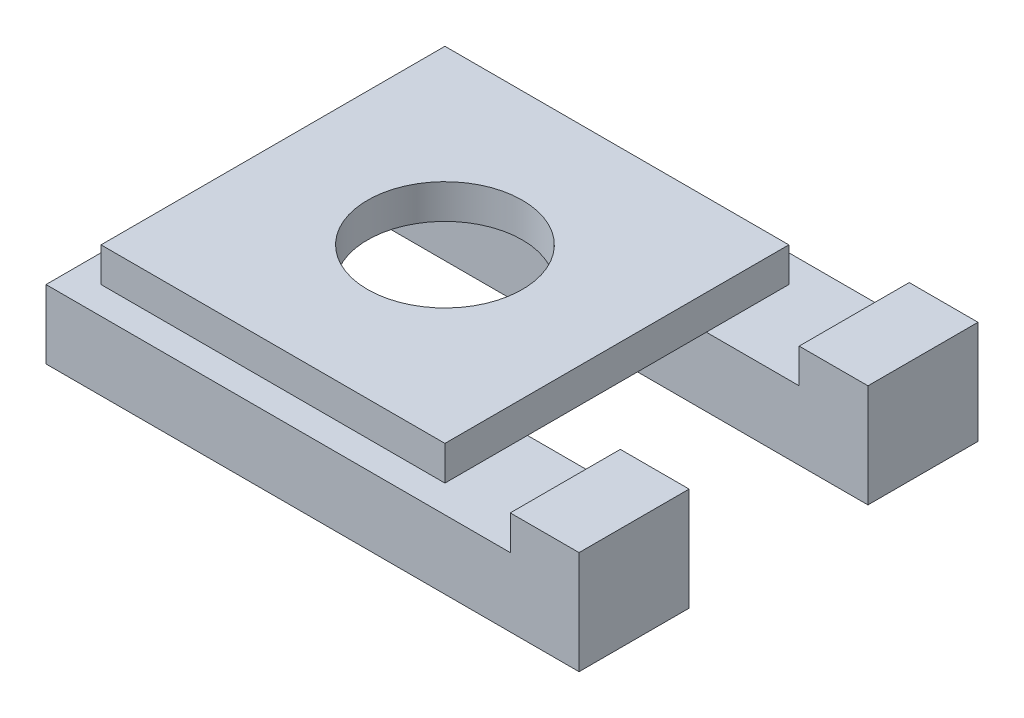
from build123d import *

# Parameters (mm, degrees)
SKETCH1_W           = 100
SKETCH1_H           = 100
SKETCH1_R           = 22.5
BOSS_EXTRUDE1_DEPTH = 10
BOSS_EXTRUDE2_START = 8
BOSS_EXTRUDE2_DEPTH = 32


with BuildPart() as part:
    # Sketch1 → Boss-Extrude1 (new body)
    with BuildSketch(Plane(origin=(0, 0, 0), x_dir=(1, 0, 0), z_dir=(0, 1, 0))):
        Rectangle(SKETCH1_W, SKETCH1_H)
        with Locations(Location((0, 0, 0), (0, 0, 270))):
            Circle(SKETCH1_R, mode=Mode.SUBTRACT)
    extrude(amount=BOSS_EXTRUDE1_DEPTH)

    # Sketch2 → Boss-Extrude2 (add)
    with BuildSketch(Plane.XY.offset(50).offset(BOSS_EXTRUDE2_START)):
        Polygon((-58, 0), (-58, -20), (97, -20), (97, 10), (77, 10), (77, 0), align=None)
    boss_extrude2 = extrude(amount=-BOSS_EXTRUDE2_DEPTH)

    # Mirror1: Boss-Extrude2 across plane
    add(boss_extrude2.mirror(Plane.XY))


solid = part.part
